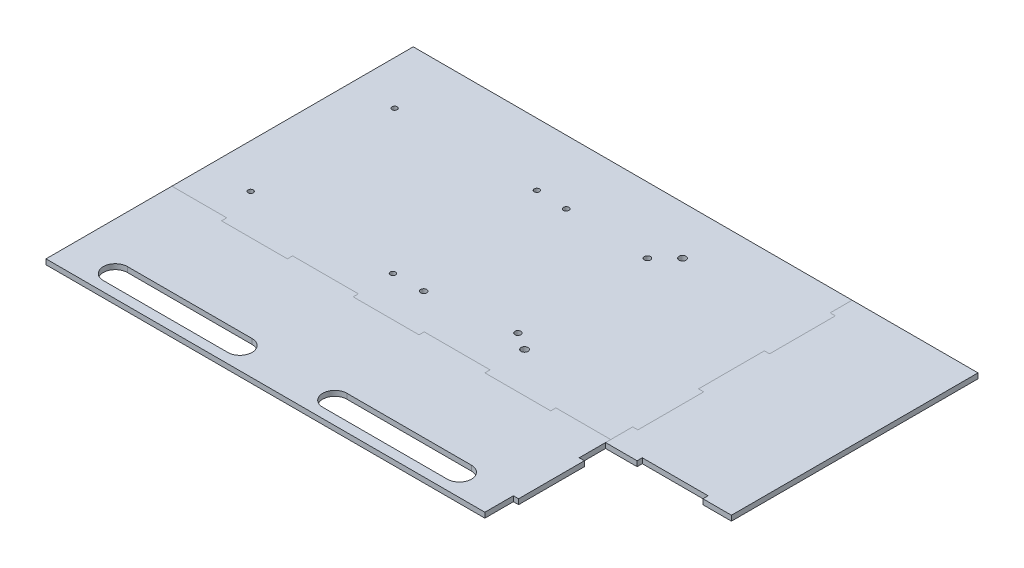
from build123d import *

# Parameters (mm, degrees)
BOSS_EXTRUDE1_DEPTH = 3
BOSS_EXTRUDE2_DEPTH = 3
BOSS_EXTRUDE3_DEPTH = 3
CUT_EXTRUDE1_DEPTH  = 3
SKETCH5_R           = 1.5
SKETCH5_R_2         = 1.75
SKETCH5_R_3         = 1.588777233
SKETCH5_R_4         = 2
CUT_EXTRUDE2_DEPTH  = 3


with BuildPart() as part:
    # Sketch1 → Boss-Extrude1 (new body)
    with BuildSketch(Plane(origin=(0, 0, 0), x_dir=(1, 0, 0), z_dir=(0, 1, 0))):
        Polygon((0, 0), (31.75, 0), (31.75, -3), (69.85, -3), (69.85, 0), (107.95, 0), (107.95, -3), (146.05, -3), (146.05, 0), (184.15, 0), (184.15, -3), (222.25, -3), (222.25, 0), (254, 0), (254, 12.7), (257, 12.7), (257, 50.8), (254, 50.8), (254, 88.9), (257, 88.9), (257, 127), (254, 127), (254, 139.7), (0, 139.7), align=None)
    extrude(amount=BOSS_EXTRUDE1_DEPTH)

    # Sketch5 → Cut-Extrude2 (cut)
    with BuildSketch(Plane(origin=(0, 3, 0), x_dir=(1, 0, 0), z_dir=(0, 1, 0))):
        with Locations(Location((25.4, 20.207792239, 0), (0, 0, 270))):
            Circle(SKETCH5_R)
        with Locations(Location((25.4, 103.519792239, 0), (0, 0, 270))):
            Circle(SKETCH5_R)
        with Locations(Location((107.7, 20.207792239, 0), (0, 0, 270))):
            Circle(SKETCH5_R)
        with Locations(Location((107.7, 103.519792239, 0), (0, 0, 270))):
            Circle(SKETCH5_R)
        with Locations(Location((173.74, 101.487792239, 0), (0, 0, 270))):
            Circle(SKETCH5_R_2)
        with Locations(Location((173.74, 26.557792239, 0), (0, 0, 270))):
            Circle(SKETCH5_R_2)
        with Locations(Location((125.48, 20.207792239, 0), (0, 0, 270))):
            Circle(SKETCH5_R_2)
        with Locations(Location((125.48, 102.757792239, 0), (0, 0, 270))):
            Circle(SKETCH5_R_3)
        with Locations(Location((183.9, 111.647792239, 0), (0, 0, 270))):
            Circle(SKETCH5_R_4)
        with Locations(Location((183.9, 20.207792239, 0), (0, 0, 270))):
            Circle(SKETCH5_R_4)
    extrude(amount=-CUT_EXTRUDE2_DEPTH, mode=Mode.SUBTRACT)


with BuildPart() as body_2:
    # Sketch2 → Boss-Extrude2 (new body)
    with BuildSketch(Plane(origin=(0, 0, 0), x_dir=(1, 0, 0), z_dir=(0, 1, 0))):
        Polygon((0, 0), (31.75, 0), (31.75, -3), (69.85, -3), (69.85, 0), (107.95, 0), (107.95, -3), (146.05, -3), (146.05, 0), (184.15, 0), (184.15, -3), (222.25, -3), (222.25, 0), (254, 0), (254, -18.24), (257, -18.24), (257, -56.34), (254, -56.34), (254, -72.85), (0, -72.85), align=None)
    extrude(amount=BOSS_EXTRUDE2_DEPTH)

    # Sketch4 → Cut-Extrude1 (cut)
    with BuildSketch(Plane(origin=(0, 3, 0), x_dir=(1, 0, 0), z_dir=(0, 1, 0))):
        with BuildLine():
            Line((27.455356566, -53.15), (99.544643434, -53.15))
            ThreePointArc((99.544643434, -53.15), (106.544643434, -60.15), (99.544643434, -67.15))
            Line((99.544643434, -67.15), (27.455356566, -67.15))
            ThreePointArc((27.455356566, -67.15), (20.455356566, -60.15), (27.455356566, -53.15))
        make_face()
        with BuildLine():
            Line((226.544643434, -53.15), (154.455356566, -53.15))
            ThreePointArc((154.455356566, -53.15), (147.455356566, -60.15), (154.455356566, -67.15))
            Line((154.455356566, -67.15), (226.544643434, -67.15))
            ThreePointArc((226.544643434, -67.15), (233.544643434, -60.15), (226.544643434, -53.15))
        make_face()
    extrude(amount=-CUT_EXTRUDE1_DEPTH, mode=Mode.SUBTRACT)


with BuildPart() as body_3:
    # Sketch3 → Boss-Extrude3 (new body)
    with BuildSketch(Plane(origin=(0, 0, 0), x_dir=(1, 0, 0), z_dir=(0, 1, 0))):
        Polygon((254, -3), (254, 12.7), (257.000000096, 12.7), (257.000000096, 50.8), (254, 50.8), (254, 88.9), (257.000000096, 88.9), (257.000000096, 127), (254, 127), (254, 139.7), (326.85, 139.7), (326.85, -3), (310.34, -3), (310.34, 9.6e-08), (272.24, 9.6e-08), (272.24, -3), align=None)
    extrude(amount=BOSS_EXTRUDE3_DEPTH)


solid = Compound([part.part, body_2.part, body_3.part])
